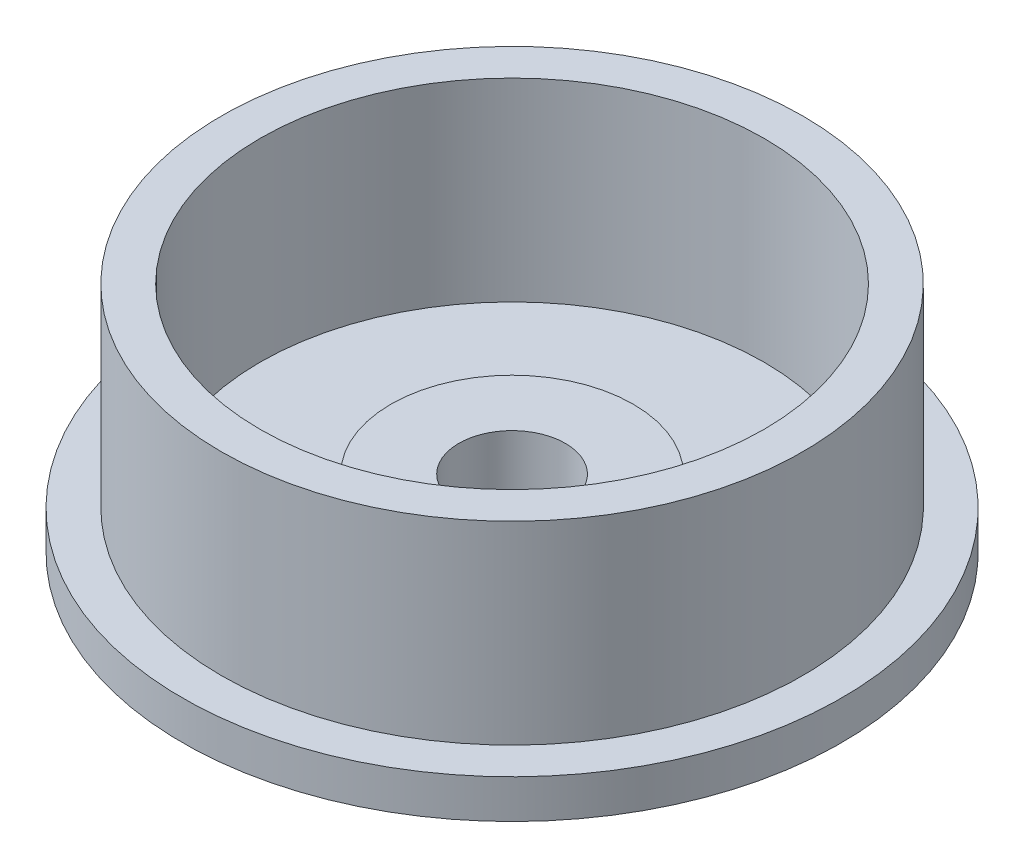
from build123d import *

# Parameters (mm, degrees)
SKETCH2_R           = 15
BOSS_EXTRUDE1_DEPTH = 12
SHELL1_T            = -2
SKETCH4_R           = 2.75
CUT_EXTRUDE1_DEPTH  = 25.372115214
SKETCH5_R           = 17
SKETCH5_R_2         = 15
BOSS_EXTRUDE3_DEPTH = 2
BOSS_EXTRUDE5_START = 4
SKETCH7_R           = 4.25
SKETCH7_R_2         = 2.75
BOSS_EXTRUDE5_DEPTH = 4
SKETCH6_R           = 6.25
SKETCH6_R_2         = 2.75
BOSS_EXTRUDE4_DEPTH = 1.5


with BuildPart() as part:
    # Sketch2 → Boss-Extrude1 (new body)
    with BuildSketch(Plane(origin=(0, 0, 0), x_dir=(1, 0, 0), z_dir=(0, 1, 0))):
        with Locations(Location((0, 0, 0), (0, 0, 270))):
            Circle(SKETCH2_R)
    extrude(amount=BOSS_EXTRUDE1_DEPTH)

    # Shell1
    shell1_openings = [part.faces().sort_by_distance(p)[0] for p in [
        (0, 12, 0),
    ]]
    offset(amount=SHELL1_T, openings=shell1_openings, kind=Kind.INTERSECTION)

    # Sketch4 → Cut-Extrude1 (cut, through all)
    with BuildSketch(Plane.XZ):
        with Locations(Location((0, 0, 0), (0, 0, 270))):
            Circle(SKETCH4_R)
    extrude(amount=-CUT_EXTRUDE1_DEPTH, mode=Mode.SUBTRACT)

    # Sketch5 → Boss-Extrude3 (add)
    with BuildSketch(Plane.XZ):
        with Locations(Location((0, 0, 0), (0, 0, 270))):
            Circle(SKETCH5_R)
        with Locations(Location((0, 0, 0), (0, 0, 270))):
            Circle(SKETCH5_R_2, mode=Mode.SUBTRACT)
    extrude(amount=-BOSS_EXTRUDE3_DEPTH)

    # Sketch7 → Boss-Extrude5 (add)
    with BuildSketch(Plane.XZ.offset(BOSS_EXTRUDE5_START)):
        with Locations(Location((0, 0, 0), (0, 0, 90))):
            Circle(SKETCH7_R)
        with Locations(Location((0, 0, 0), (0, 0, 270))):
            Circle(SKETCH7_R_2, mode=Mode.SUBTRACT)
    extrude(amount=-BOSS_EXTRUDE5_DEPTH)

    # Sketch6 → Boss-Extrude4 (add)
    with BuildSketch(Plane(origin=(0, 2, 0), x_dir=(1, 0, 0), z_dir=(0, 1, 0))):
        with Locations(Location((0, 0, 0), (0, 0, 90))):
            Circle(SKETCH6_R)
        with Locations(Location((0, 0, 0), (0, 0, 90))):
            Circle(SKETCH6_R_2, mode=Mode.SUBTRACT)
    extrude(amount=BOSS_EXTRUDE4_DEPTH)


solid = part.part
